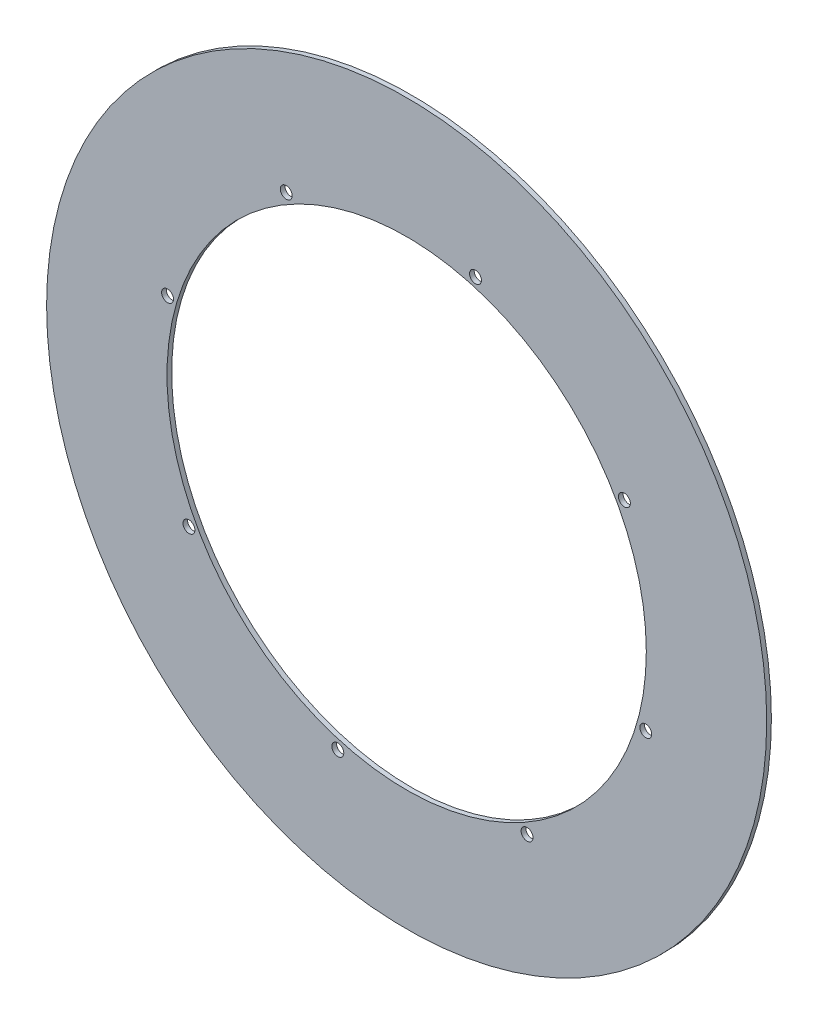
from build123d import *

# Parameters (mm, degrees)
SKETCH1_R           = 154
SKETCH1_R_2         = 102.5
SKETCH1_R_3         = 2.544731427
BOSS_EXTRUDE1_DEPTH = 2


with BuildPart() as part:
    # Sketch1 → Boss-Extrude1 (new body)
    with BuildSketch(Plane.XY):
        Circle(SKETCH1_R)
        Circle(SKETCH1_R_2, mode=Mode.SUBTRACT)
        with Locations((102.263864137, -29.439514058)):
            Circle(SKETCH1_R_3, mode=Mode.SUBTRACT)
        with Locations((93.128351827, 51.494591777)):
            Circle(SKETCH1_R_3, mode=Mode.SUBTRACT)
        with Locations((51.494591777, -93.128351827)):
            Circle(SKETCH1_R_3, mode=Mode.SUBTRACT)
        with Locations((-29.439514058, -102.263864137)):
            Circle(SKETCH1_R_3, mode=Mode.SUBTRACT)
        with Locations((-93.128351827, -51.494591777)):
            Circle(SKETCH1_R_3, mode=Mode.SUBTRACT)
        with Locations((-102.263864137, 29.439514058)):
            Circle(SKETCH1_R_3, mode=Mode.SUBTRACT)
        with Locations((-51.494591777, 93.128351827)):
            Circle(SKETCH1_R_3, mode=Mode.SUBTRACT)
        with Locations((29.439514058, 102.263864137)):
            Circle(SKETCH1_R_3, mode=Mode.SUBTRACT)
    extrude(amount=BOSS_EXTRUDE1_DEPTH)


solid = part.part
